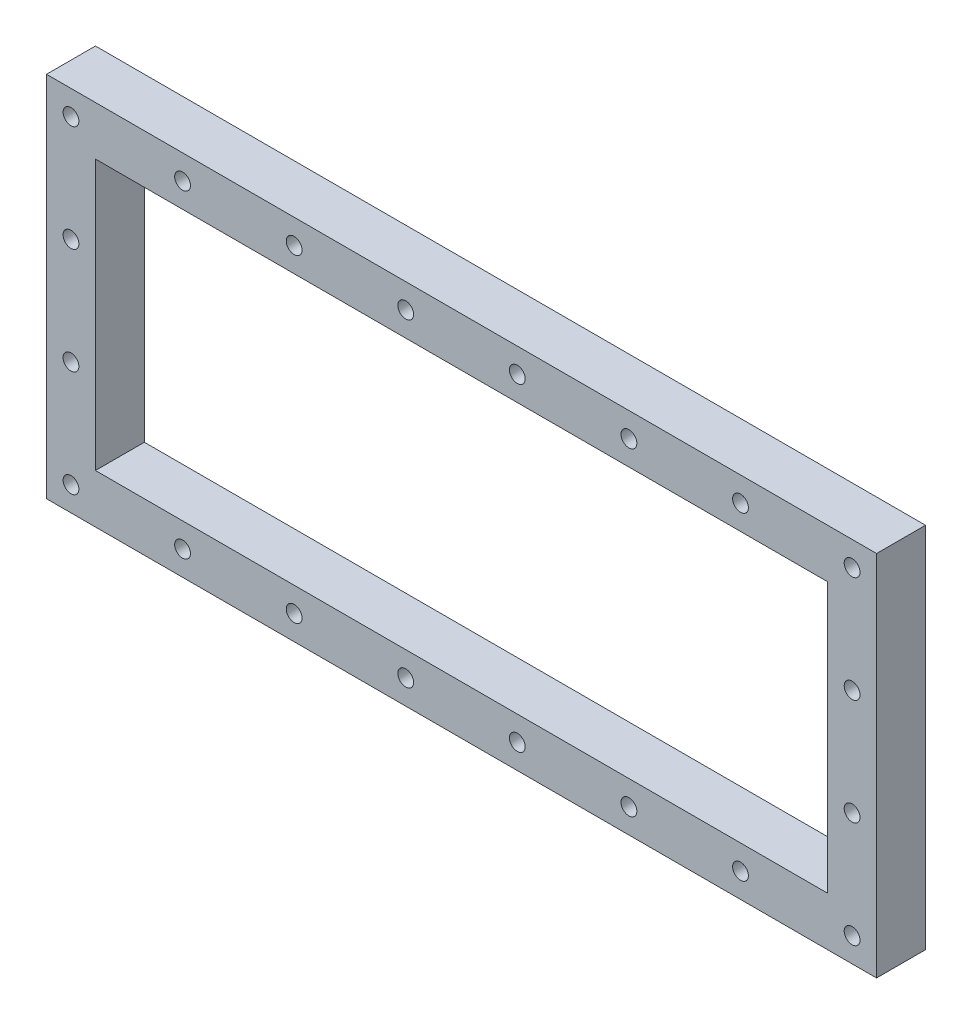
from build123d import *

# Parameters (mm, degrees)
SKETCH1_W           = 107.7
SKETCH1_H           = 47.7
SKETCH1_R           = 1.025
SKETCH1_W_2         = 95
SKETCH1_H_2         = 35
BOSS_EXTRUDE1_DEPTH = 6.35


with BuildPart() as part:
    # Sketch1 → Boss-Extrude1 (new body)
    with BuildSketch(Plane.XY):
        Rectangle(SKETCH1_W, SKETCH1_H)
        with Locations((-50.675, 20.675)):
            Circle(SKETCH1_R, mode=Mode.SUBTRACT)
        with Locations((50.675, 20.675)):
            Circle(SKETCH1_R, mode=Mode.SUBTRACT)
        with Locations((-50.675, -20.675)):
            Circle(SKETCH1_R, mode=Mode.SUBTRACT)
        with Locations((50.675, -20.675)):
            Circle(SKETCH1_R, mode=Mode.SUBTRACT)
        with Locations((-7.239285714, 20.675)):
            Circle(SKETCH1_R, mode=Mode.SUBTRACT)
        with Locations((-7.239285714, -20.675)):
            Circle(SKETCH1_R, mode=Mode.SUBTRACT)
        with Locations((-36.196428571, 20.675)):
            Circle(SKETCH1_R, mode=Mode.SUBTRACT)
        with Locations((-21.717857143, 20.675)):
            Circle(SKETCH1_R, mode=Mode.SUBTRACT)
        with Locations((7.239285714, 20.675)):
            Circle(SKETCH1_R, mode=Mode.SUBTRACT)
        with Locations((21.717857143, 20.675)):
            Circle(SKETCH1_R, mode=Mode.SUBTRACT)
        with Locations((-50.675, 6.8916667)):
            Circle(SKETCH1_R, mode=Mode.SUBTRACT)
        with Locations((-50.675, -6.8916667)):
            Circle(SKETCH1_R, mode=Mode.SUBTRACT)
        with Locations((50.675, 6.8916667)):
            Circle(SKETCH1_R, mode=Mode.SUBTRACT)
        with Locations((50.675, -6.8916667)):
            Circle(SKETCH1_R, mode=Mode.SUBTRACT)
        with Locations((7.239285714, -20.675)):
            Circle(SKETCH1_R, mode=Mode.SUBTRACT)
        with Locations((21.717857143, -20.675)):
            Circle(SKETCH1_R, mode=Mode.SUBTRACT)
        with Locations((-21.717857143, -20.675)):
            Circle(SKETCH1_R, mode=Mode.SUBTRACT)
        with Locations((-36.196428571, -20.675)):
            Circle(SKETCH1_R, mode=Mode.SUBTRACT)
        with Locations((36.196428572, 20.675)):
            Circle(SKETCH1_R, mode=Mode.SUBTRACT)
        with Locations((36.196428572, -20.675)):
            Circle(SKETCH1_R, mode=Mode.SUBTRACT)
        Rectangle(SKETCH1_W_2, SKETCH1_H_2, mode=Mode.SUBTRACT)
    extrude(amount=BOSS_EXTRUDE1_DEPTH)


solid = part.part
